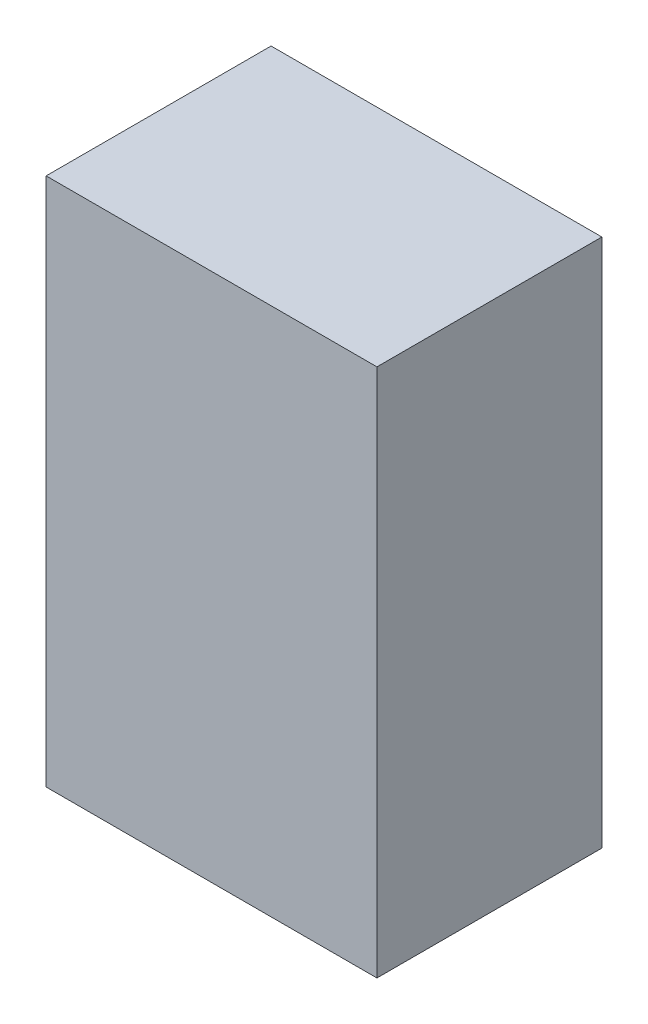
from build123d import *

# Parameters (mm, degrees)
SKETCH1_W           = 317.5
SKETCH1_H           = 215.9
BOSS_EXTRUDE1_DEPTH = 508


with BuildPart() as part:
    # Sketch1 → Boss-Extrude1 (new body)
    with BuildSketch(Plane(origin=(0, 0, 0), x_dir=(1, 0, 0), z_dir=(0, 1, 0))):
        Rectangle(SKETCH1_W, SKETCH1_H)
    extrude(amount=BOSS_EXTRUDE1_DEPTH)


solid = part.part
